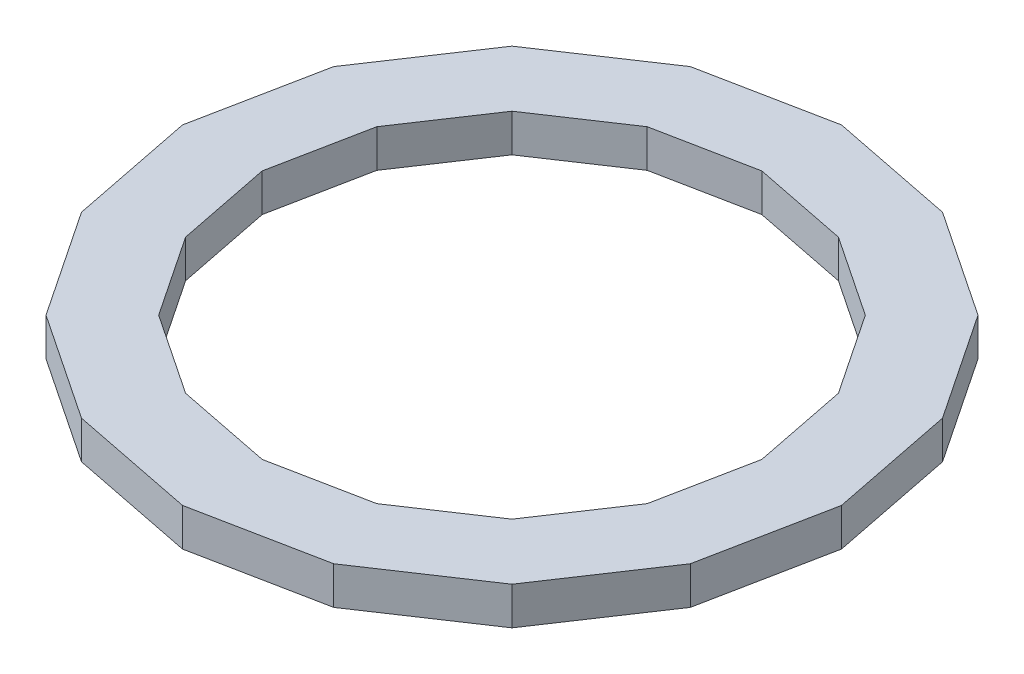
from build123d import *

# Parameters (mm, degrees)
BOSS_EXTRUDE1_DEPTH = 19.05


with BuildPart() as part:
    # Sketch1 → Boss-Extrude1 (new body)
    with BuildSketch(Plane(origin=(0, 0, 0), x_dir=(1, 0, 0), z_dir=(0, 1, 0))):
        Polygon((166.00003355, 0), (153.364033393, 63.525462612), (117.379749401, 117.379749401), (63.525462612, 153.364033393), (0, 166.00003355), (-63.525462612, 153.364033393), (-117.379749401, 117.379749401), (-153.364033393, 63.525462612), (-166.00003355, 0), (-153.364033393, -63.525462612), (-117.379749401, -117.379749401), (-63.525462612, -153.364033393), (0, -166.00003355), (63.525462612, -153.364033393), (117.379749401, -117.379749401), (153.364033393, -63.525462612), align=None)
        Polygon((125.858729652, 0), (116.278304313, 48.164050656), (88.995561208, 88.995561208), (48.164050656, 116.278304313), (0, 125.858729652), (-48.164050656, 116.278304313), (-88.995561208, 88.995561208), (-116.278304313, 48.164050656), (-125.858729652, 0), (-116.278304313, -48.164050656), (-88.995561208, -88.995561208), (-48.164050656, -116.278304313), (0, -125.858729652), (48.164050656, -116.278304313), (88.995561208, -88.995561208), (116.278304313, -48.164050656), align=None, mode=Mode.SUBTRACT)
    extrude(amount=BOSS_EXTRUDE1_DEPTH)


solid = part.part
